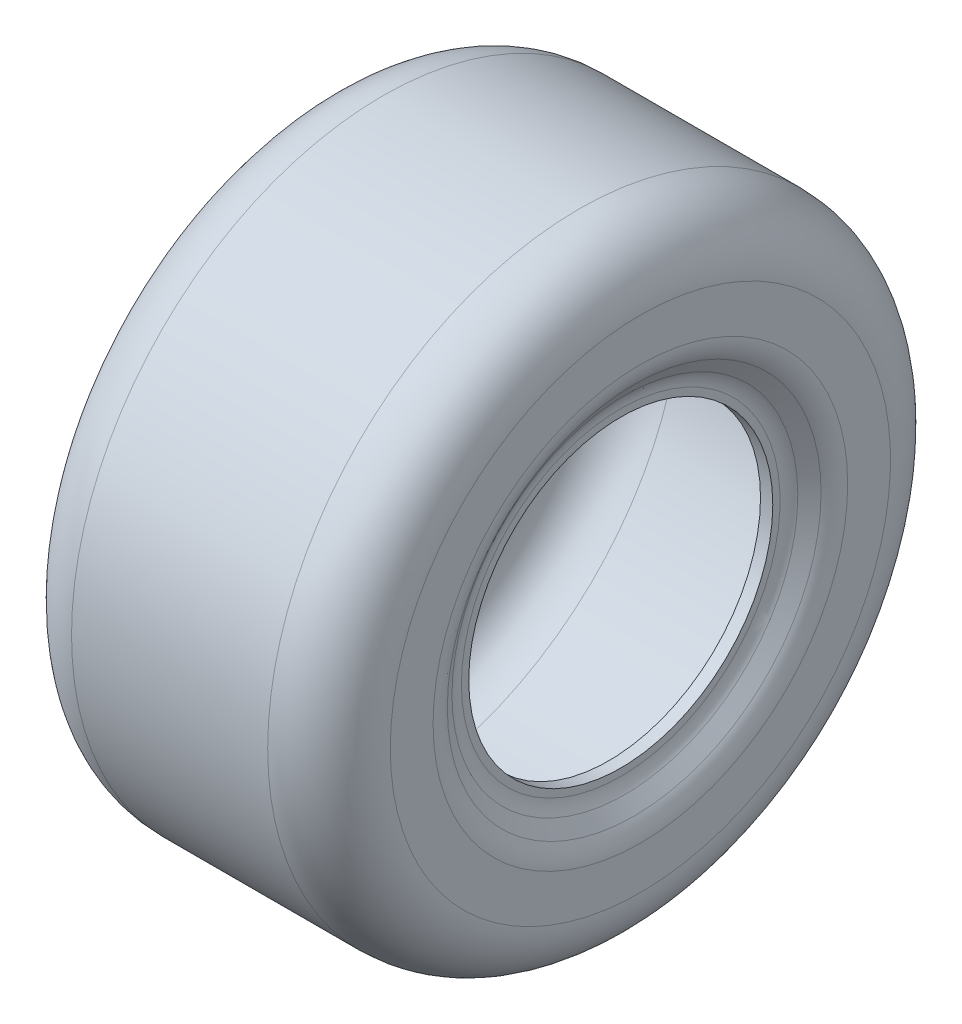
from build123d import *


with BuildPart() as part:
    # Sketch2 → Revolve1 (revolve)
    with BuildSketch(Plane.XY, mode=Mode.PRIVATE) as revolve1_sk:
        with BuildLine():
            Line((0, 127), (-40, 127))
            ThreePointArc((-40, 127), (-57.67766953, 119.67766953), (-65, 102))
            Line((-65, 102), (-65, 84.541634566))
            ThreePointArc((-65, 84.541634566), (-64.356380397, 80.194872336), (-62.480754415, 76.221131623))
            Line((-62.480754415, 76.221131623), (-58.679497057, 70.519245585))
            ThreePointArc((-58.679497057, 70.519245585), (-57.429079735, 67.87008511), (-57, 64.972243623))
            Line((-57, 64.972243623), (-57, 62))
            Line((-57, 62), (-52, 62))
            Line((-52, 62), (-52, 64.972243623))
            ThreePointArc((-52, 64.972243623), (-52.643619603, 69.319005853), (-54.519245585, 73.292746566))
            Line((-54.519245585, 73.292746566), (-58.320502943, 78.994632604))
            ThreePointArc((-58.320502943, 78.994632604), (-59.570920265, 81.643793079), (-60, 84.541634566))
            Line((-60, 84.541634566), (-60, 102))
            ThreePointArc((-60, 102), (-54.142135624, 116.142135624), (-40, 122))
            Line((-40, 122), (0, 122))
            Line((0, 122), (40, 122))
            ThreePointArc((40, 122), (54.142135624, 116.142135624), (60, 102))
            Line((60, 102), (60, 84.541634566))
            ThreePointArc((60, 84.541634566), (59.570920265, 81.643793079), (58.320502943, 78.994632604))
            Line((58.320502943, 78.994632604), (54.519245585, 73.292746566))
            ThreePointArc((54.519245585, 73.292746566), (52.643619603, 69.319005853), (52, 64.972243623))
            Line((52, 64.972243623), (52, 62))
            Line((52, 62), (57, 62))
            Line((57, 62), (57, 64.972243623))
            ThreePointArc((57, 64.972243623), (57.429079735, 67.87008511), (58.679497057, 70.519245585))
            Line((58.679497057, 70.519245585), (62.480754415, 76.221131623))
            ThreePointArc((62.480754415, 76.221131623), (64.356380397, 80.194872336), (65, 84.541634566))
            Line((65, 84.541634566), (65, 102))
            ThreePointArc((65, 102), (57.67766953, 119.67766953), (40, 127))
            Line((40, 127), (0, 127))
        make_face()
    revolve(revolve1_sk.sketch.rotate(Axis((-65, 0, 0), (1, 0, 0)), 90), axis=Axis((-65, 0, 0), (1, 0, 0)))


solid = part.part
